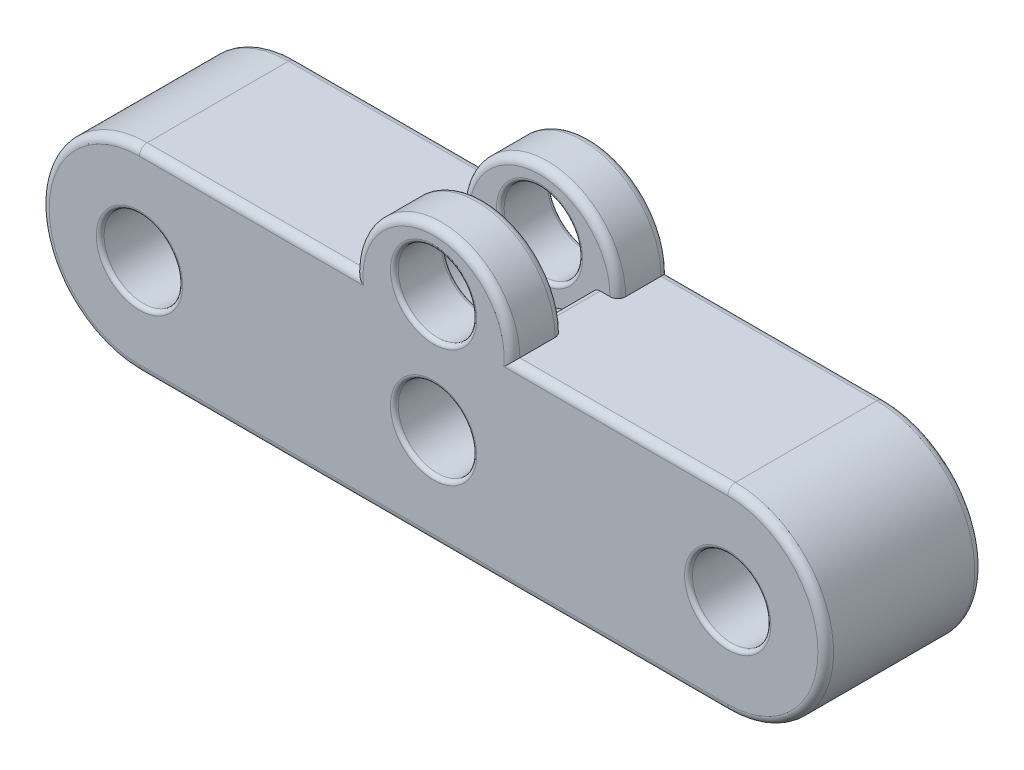
from build123d import *

# Parameters (mm, degrees)
ESQUISSE1_R             = 10
BOSS_EXTRU_1_DEPTH      = 40
BOSS_EXTRU_6_DEPTH      = 13
BOSS_EXTRU_7_START      = -13
BOSS_EXTRU_7_DEPTH      = 13
ENL_V_START             = -40
ENL_V_MAT_EXTRU_3_DEPTH = 40
ESQUISSE16_R            = 15
ENL_V_MAT_EXTRU_8_DEPTH = 14
CONG_4_R                = 2
CONG_5_R                = 1


with BuildPart() as part:
    # Esquisse1 → Boss.-Extru.1 (new body)
    with BuildSketch(Plane.XY):
        with BuildLine():
            Line((132.044850808, 25.192012488), (-17.955149192, 25.192012488))
            ThreePointArc((-17.955149192, 25.192012488), (-42.955149192, 0.192012488), (-17.955149192, -24.807987512))
            Line((-17.955149192, -24.807987512), (132.044850808, -24.807987512))
            ThreePointArc((132.044850808, -24.807987512), (157.044850808, 0.192012488), (132.044850808, 25.192012488))
        make_face()
        with Locations((57.044850808, 0.192012488)):
            Circle(ESQUISSE1_R, mode=Mode.SUBTRACT)
        with Locations((132.044850808, 0.192012488)):
            Circle(ESQUISSE1_R, mode=Mode.SUBTRACT)
        with Locations((-17.955149192, 0.192012488)):
            Circle(ESQUISSE1_R, mode=Mode.SUBTRACT)
    extrude(amount=BOSS_EXTRU_1_DEPTH)

    # Esquisse2 → Boss.-Extru.6 (add)
    with BuildSketch(Plane(origin=(0, 0, 0), x_dir=(-1, 0, 0), z_dir=(0, 0, -1))):
        with BuildLine():
            Line((-77.044850808, 25.192012488), (-65.705104846, 25.192012488))
            ThreePointArc((-65.705104846, 25.192012488), (-59.633041259, 39.85127075), (-47.044850808, 30.192012488))
            ThreePointArc((-47.044850808, 30.192012488), (-47.385592546, 27.603822037), (-48.384596771, 25.192012488))
            Line((-48.384596771, 25.192012488), (-37.044850808, 25.192012488))
            ThreePointArc((-37.044850808, 25.192012488), (-57.044850808, 45.192012488), (-77.044850808, 25.192012488))
        make_face()
    extrude(amount=-BOSS_EXTRU_6_DEPTH)

    # Esquisse12 → Boss.-Extru.7 (add)
    with BuildSketch(Plane.XY.offset(40).offset(BOSS_EXTRU_7_START)):
        with BuildLine():
            ThreePointArc((48.384596771, 25.192012488), (57.044850808, 40.192012488), (65.705104846, 25.192012488))
            Line((65.705104846, 25.192012488), (77.044850808, 25.192012488))
            ThreePointArc((77.044850808, 25.192012488), (57.044850808, 45.192012488), (37.044850808, 25.192012488))
            Line((37.044850808, 25.192012488), (48.384596771, 25.192012488))
        make_face()
    extrude(amount=BOSS_EXTRU_7_DEPTH)

    # Esquisse14 → Enlèv. mat.-Extru.3 (cut)
    with BuildSketch(Plane.XY.offset(40).offset(ENL_V_START)):
        with BuildLine():
            Line((65.705104846, 25.192012488), (57.044850808, 25.192012488))
            Line((57.044850808, 25.192012488), (48.384596771, 25.192012488))
            ThreePointArc((48.384596771, 25.192012488), (57.044850808, 20.192012488), (65.705104846, 25.192012488))
        make_face()
    extrude(amount=ENL_V_MAT_EXTRU_3_DEPTH, mode=Mode.SUBTRACT)

    # Esquisse16 → Enlèv. mat.-Extru.8 (cut)
    with BuildSketch(Plane(origin=(0, 0, 27), x_dir=(-1, 0, 0), z_dir=(0, 0, -1))):
        with Locations((-57.044850808, 30.192012488)):
            Circle(ESQUISSE16_R)
    extrude(amount=ENL_V_MAT_EXTRU_8_DEPTH, mode=Mode.SUBTRACT)

    # Congé4
    cong_4_edges = [part.edges().sort_by_distance(p)[0] for p in [
        (57.044850808, 45.192012488, 0),
        (57.044850808, 45.192012488, 13),
        (57.044850808, 45.192012488, 40),
        (57.044850808, 45.192012488, 27),
        (71.186986432, 25.192012488, 20),
        (42.902715185, 25.192012488, 20),
        (157.044850808, 0.192012488, 40),
        (157.044850808, 0.192012488, 0),
        (104.544850808, 25.192012488, 0),
        (104.544850808, 25.192012488, 40),
        (57.044850808, -24.807987512, 40),
        (57.044850808, -24.807987512, 0),
        (-42.955149192, 0.192012488, 0),
        (-42.955149192, 0.192012488, 40),
        (9.544850808, 25.192012488, 0),
        (9.544850808, 25.192012488, 40),
    ]]
    fillet(cong_4_edges, radius=CONG_4_R)

    # Congé5
    cong_5_edges = [part.edges().sort_by_distance(p)[0] for p in [
        (-27.955149192, 0.192012488, 0),
        (122.044850808, 0.192012488, 0),
        (47.044850808, 0.192012488, 0),
        (67.044850808, 30.192012488, 0),
        (65.705104846, 35.192012488, 27),
        (122.044850808, 0.192012488, 40),
        (-27.955149192, 0.192012488, 40),
        (47.044850808, 0.192012488, 40),
        (65.705104846, 35.192012488, 40),
        (67.044850808, 30.192012488, 13),
    ]]
    fillet(cong_5_edges, radius=CONG_5_R)


solid = part.part
